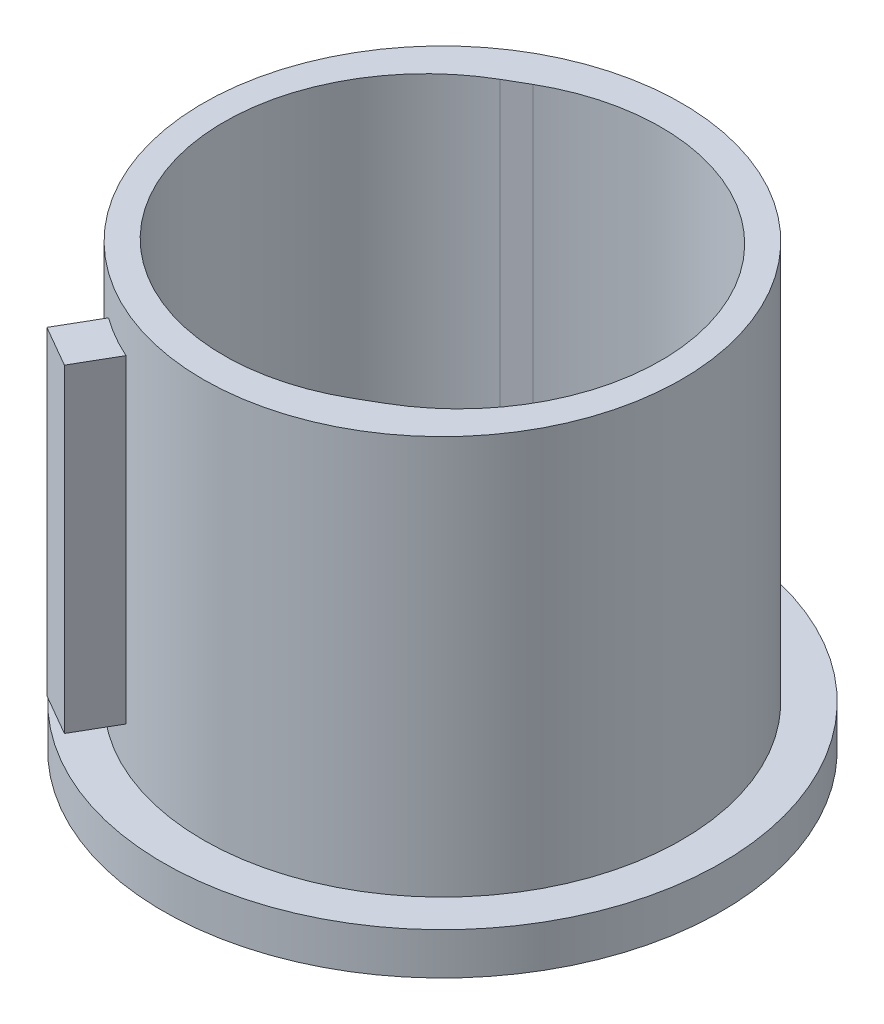
from build123d import *

# Parameters (mm, degrees)
GUIDE_BUSH_BARREL_SKETCH_R      = 6
GUIDE_BUSH_BARREL_DEPTH         = 10
GUIDE_BUSH_FLANGE_SKETCH_R      = 7
GUIDE_BUSH_FLANGE_DEPTH         = 1.05
DIRECTIONAL_RUNNING_SLOT_DEPTH  = 11.25
ANTIROTATION_GUIDE_KEY_SKETCH_W = 1.3
ANTIROTATION_GUIDE_KEY_SKETCH_H = 1.2
ANTIROTATION_GUIDE_KEY_DEPTH    = 8
MOVE2_ANGLE                     = 120


with BuildPart() as part:
    # Guide bush barrel sketch → Guide bush barrel (new body)
    with BuildSketch(Plane(origin=(0, -105.98, 0), x_dir=(1, 0, 0), z_dir=(0, 1, 0))):
        with Locations(Location((-20.291651246, 0, 0), (0, 0, 270))):
            Circle(GUIDE_BUSH_BARREL_SKETCH_R)
    extrude(amount=GUIDE_BUSH_BARREL_DEPTH)

    # Guide bush flange sketch → Guide bush flange (add)
    with BuildSketch(Plane(origin=(0, -95.98, 0), x_dir=(1, 0, 0), z_dir=(0, 1, 0))):
        with Locations(Location((-20.291651246, 0, 0), (0, 0, 270))):
            Circle(GUIDE_BUSH_FLANGE_SKETCH_R)
    extrude(amount=GUIDE_BUSH_FLANGE_DEPTH)

    # Directional running slot sketch → Directional running slot (cut)
    with BuildSketch(Plane(origin=(0, -106.08, 0), x_dir=(1, 0, 0), z_dir=(0, 1, 0))):
        with BuildLine():
            Line((-23.086458867, -4.240748797), (-22.566843625, -4.540748797))
            ThreePointArc((-22.566843625, -4.540748797), (-15.641094828, -2.685), (-17.496843625, 4.240748797))
            Line((-17.496843625, 4.240748797), (-18.016458867, 4.540748797))
            ThreePointArc((-18.016458867, 4.540748797), (-24.942207664, 2.685), (-23.086458867, -4.240748797))
        make_face()
    extrude(amount=DIRECTIONAL_RUNNING_SLOT_DEPTH, mode=Mode.SUBTRACT)

    # Antirotation guide key sketch → Antirotation guide key (add)
    with BuildSketch(Plane(origin=(0, -105, 0), x_dir=(1, 0, 0), z_dir=(0, 1, 0))):
        with Locations((-13.841651246, 0)):
            Rectangle(ANTIROTATION_GUIDE_KEY_SKETCH_W, ANTIROTATION_GUIDE_KEY_SKETCH_H)
    extrude(amount=ANTIROTATION_GUIDE_KEY_DEPTH)


with BuildPart() as part_1:
    # Move1: moved
    add(part.part.moved(Location((56.291651246, 0, 0))))


with BuildPart() as part_2:
    # Move2: moved
    add(part_1.part.rotate(Axis((0, 0, 0), (0, -1, 0)), MOVE2_ANGLE))


with BuildPart() as part_3:
    # Move3: moved
    add(part_2.part.moved(Location((-56.291651246, 0, 0))))


with BuildPart() as body_2:
    # Mirror1: mirrored copy
    add(part_3.part.mirror(Plane(origin=(0, 0, 0), x_dir=(0, 0, 1), z_dir=(0, -1, 0))))


solid = body_2.part
